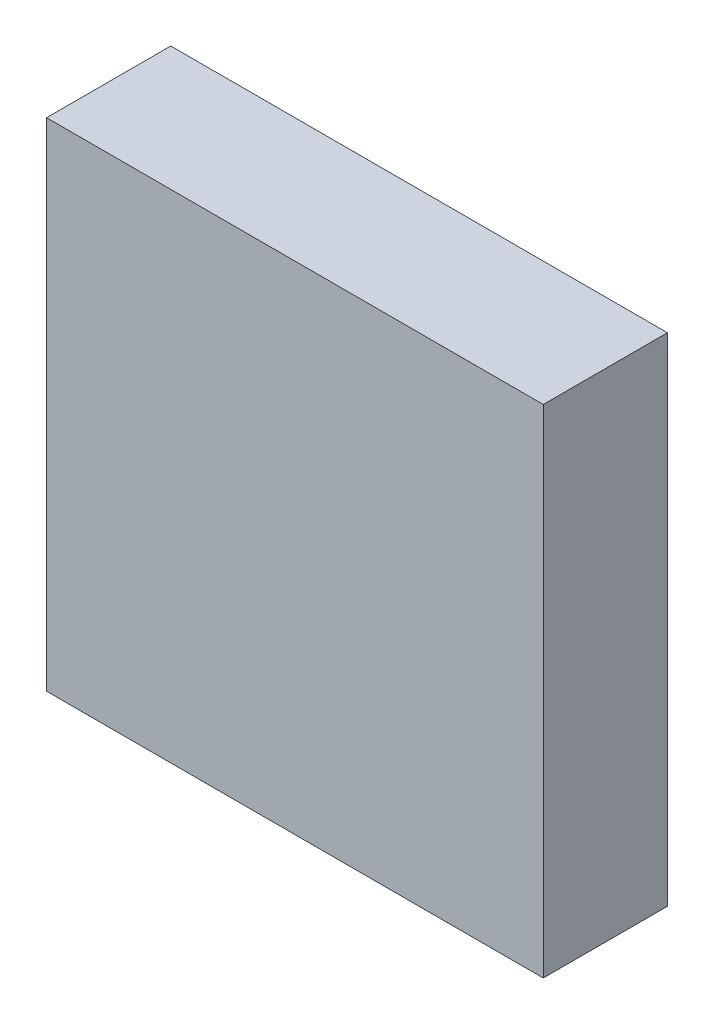
from build123d import *

# Parameters (mm, degrees)
SKETCH_1_W      = 40000
SKETCH_1_H      = 40000
EXTRUDE_1_DEPTH = 10000


with BuildPart() as part:
    # 草图1 → 凸台-拉伸1 (new body)
    with BuildSketch(Plane.XY):
        Rectangle(SKETCH_1_W, SKETCH_1_H)
    extrude(amount=-EXTRUDE_1_DEPTH)


solid = part.part
